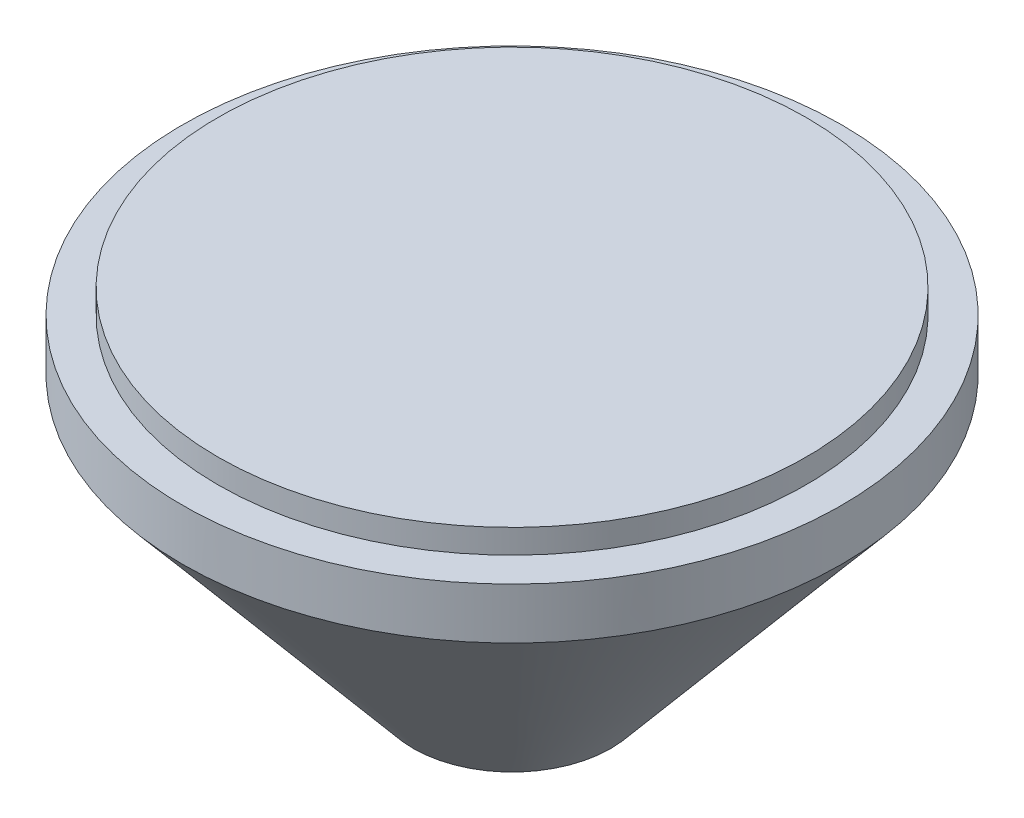
from build123d import *

# Parameters (mm, degrees)
SKETCH1_R           = 10
BOSS_EXTRUDE1_DEPTH = 10.62
SKETCH3_R           = 3
CUT_EXTRUDE1_DEPTH  = 5
CUT_EXTRUDE1_DRAFT  = -2.25
DOME1_FACE_RADIUS   = 2.803549465
DOME1_HEIGHT        = 1


with BuildPart() as part:
    # Sketch1 → Boss-Extrude1 (new body)
    with BuildSketch(Plane(origin=(0, 0, 0), x_dir=(1, 0, 0), z_dir=(0, 1, 0))):
        with Locations(Location((0, 0, 0), (0, 0, 270))):
            Circle(SKETCH1_R)
    extrude(amount=BOSS_EXTRUDE1_DEPTH)

    # Sketch2 → Cut-Revolve1 (revolve, cut)
    with BuildSketch(Plane(origin=(0, 0, 0), x_dir=(0, 0, -1), z_dir=(1, 0, 0))):
        Polygon((11, 9.89), (10, 9.89), (10, 8.34), (3, 0), (11, 0), align=None)
        Polygon((11, 10.62), (8.925, 10.62), (8.925, 9.89), (10, 9.89), (11, 9.89), align=None)
    revolve(axis=Axis((0, 0, 0), (0, 1, 0)), mode=Mode.SUBTRACT)


with BuildPart() as cut_extrude1_tool:
    # Sketch3 → Cut-Extrude1 (with draft: the straight prism first)
    with BuildSketch(Plane.XZ):
        Circle(SKETCH3_R)
    extrude(amount=-CUT_EXTRUDE1_DEPTH)
    # Cut-Extrude1: the draft: its side faces are tilted about the plane it starts from
    cut_extrude1_sides = [cut_extrude1_tool.faces().sort_by_distance(p)[0] for p in [
        (-3, 2.5, 0),
    ]]
    draft(cut_extrude1_sides, Plane.XZ, CUT_EXTRUDE1_DRAFT)


with BuildPart() as part_1:
    add(part.part)

    # Cut-Extrude1: cut by cut_extrude1_tool
    add(cut_extrude1_tool.part, mode=Mode.SUBTRACT)

    # Dome1: a dome of height H over a round flat face of radius A is a cap of a sphere of radius (A * A + H * H) / (2 * H)
    dome1_r = (DOME1_FACE_RADIUS * DOME1_FACE_RADIUS + DOME1_HEIGHT * DOME1_HEIGHT) / (2 * DOME1_HEIGHT)
    dome1_base = Plane((0, 5, 0), z_dir=(0, -1, 0))
    with Locations(dome1_base.offset(DOME1_HEIGHT - dome1_r)):
        dome1_ball = Sphere(dome1_r, mode=Mode.PRIVATE)
    add(split(dome1_ball, bisect_by=dome1_base, keep=Keep.TOP, mode=Mode.PRIVATE))


solid = part_1.part
